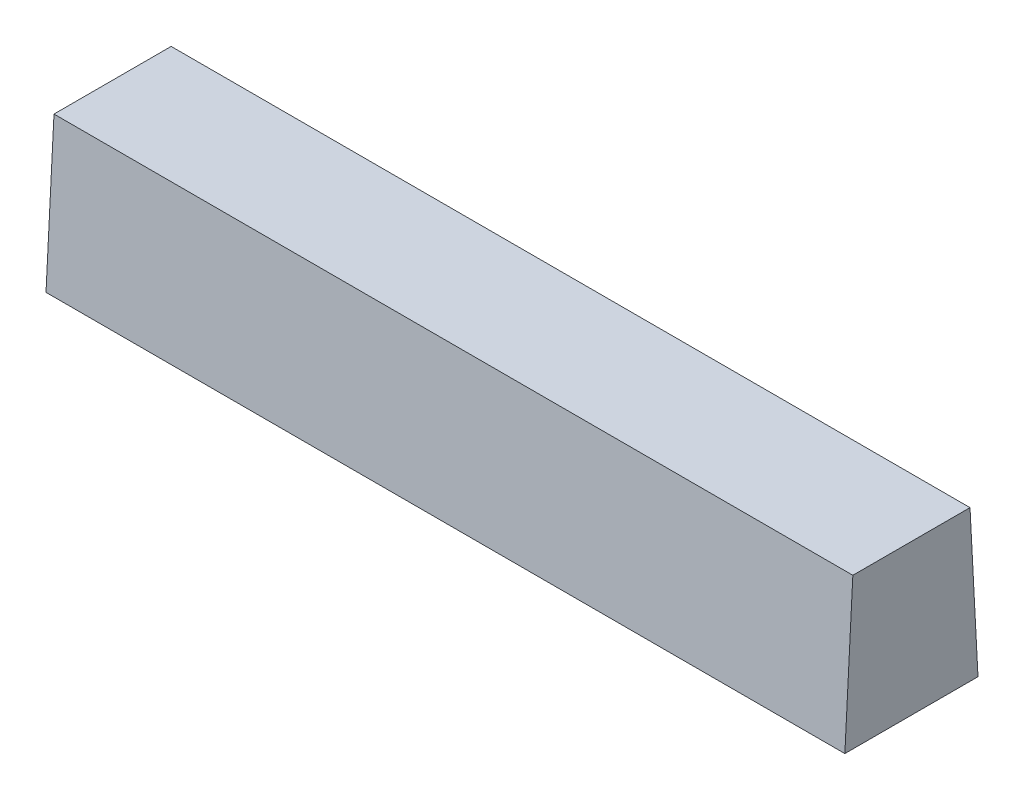
from build123d import *

# Parameters (mm, degrees)
BOSS_EXTRUDE1_DEPTH = 6


with BuildPart() as part:
    # Sketch2 → Boss-Extrude1 (new body)
    with BuildSketch(Plane(origin=(0, 0, 0), x_dir=(0, 0, -1), z_dir=(1, 0, 0))):
        Polygon((-0.44, 1.13), (0.44, 1.13), (0.5, 0), (-0.5, 0), align=None)
    extrude(amount=BOSS_EXTRUDE1_DEPTH)


solid = part.part
